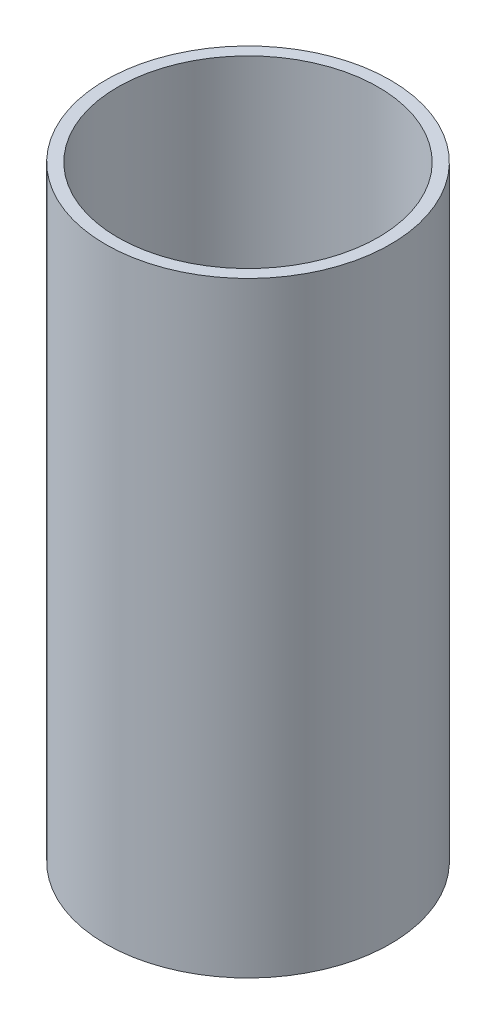
from build123d import *

# Parameters (mm, degrees)
SKETCH1_R           = 2.35
SKETCH1_R_2         = 2.15
BOSS_EXTRUDE1_DEPTH = 5


with BuildPart() as part:
    # Sketch1 → Boss-Extrude1 (new, symmetric)
    with BuildSketch(Plane(origin=(0, 0, 0), x_dir=(1, 0, 0), z_dir=(0, 1, 0))):
        with Locations(Location((0, 0, 0), (0, 0, 270))):
            Circle(SKETCH1_R)
        with Locations(Location((0, 0, 0), (0, 0, 270))):
            Circle(SKETCH1_R_2, mode=Mode.SUBTRACT)
    extrude(amount=BOSS_EXTRUDE1_DEPTH, both=True)


solid = part.part
